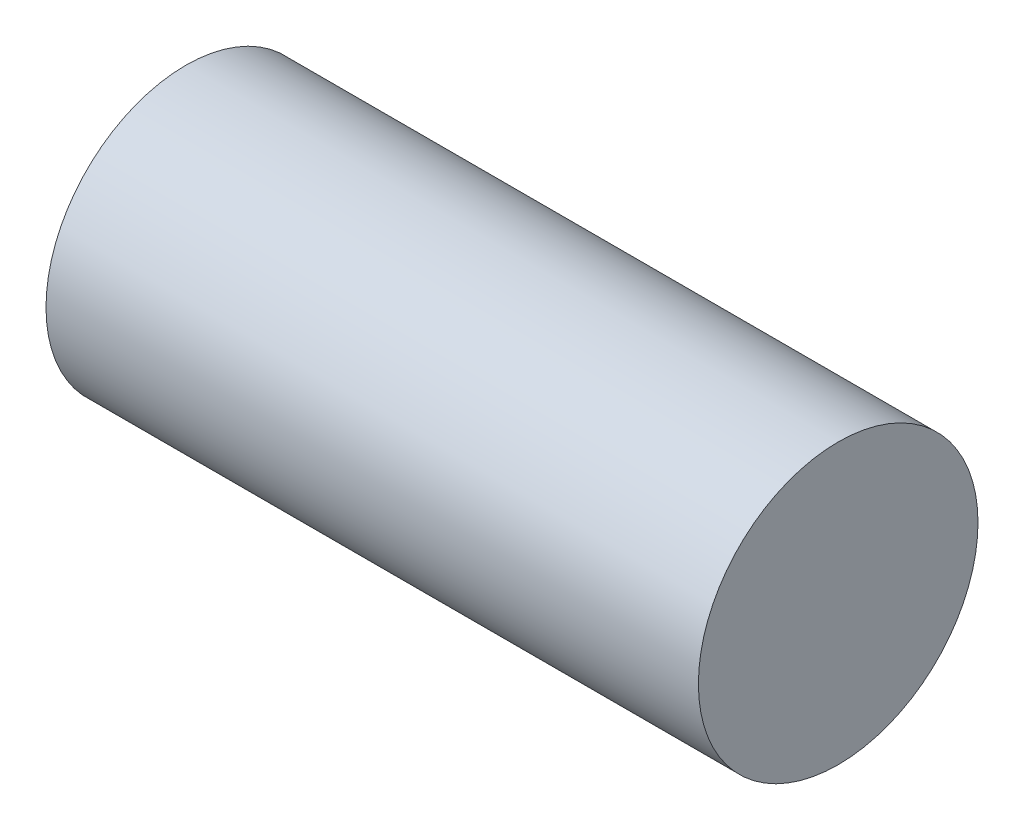
from build123d import *

# Parameters (mm, degrees)
SKETCH3_R             = 15
BOSS_EXTRUDE1_DEPTH   = 70
IZIM2_R               = 12.5
KES_EKSTR_ZYON1_DEPTH = 60


with BuildPart() as part:
    # Sketch3 → Boss-Extrude1 (new body)
    with BuildSketch(Plane(origin=(0, 0, 0), x_dir=(0, 0, -1), z_dir=(1, 0, 0))):
        Circle(SKETCH3_R)
    extrude(amount=BOSS_EXTRUDE1_DEPTH)

    # Çizim2 → Kes-Ekstrüzyon1 (cut)
    with BuildSketch(Plane(origin=(65, 0, 0), x_dir=(0, 0, -1), z_dir=(1, 0, 0))):
        Circle(IZIM2_R)
    extrude(amount=-KES_EKSTR_ZYON1_DEPTH, mode=Mode.SUBTRACT)


solid = part.part
